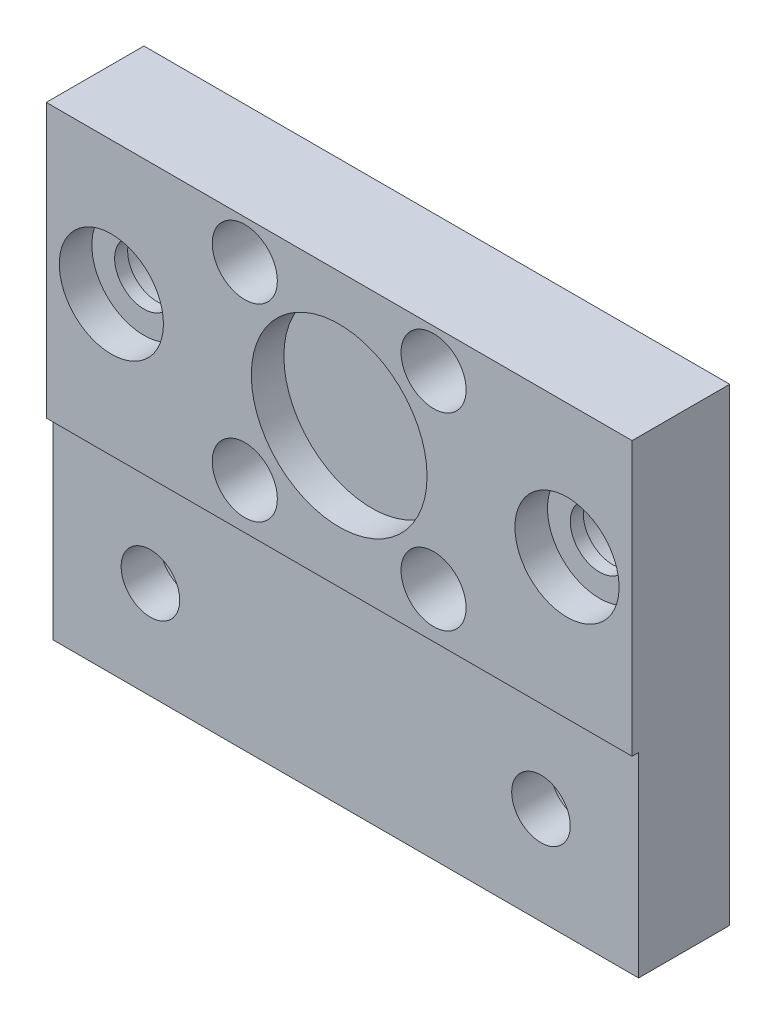
from build123d import *

# Parameters (mm, degrees)
SKETCH1_W                      = 90
SKETCH1_H                      = 72
BOSS_EXTRUDE1_DEPTH            = 15
SKETCH2_W                      = 90
SKETCH2_H                      = 30
CUT_EXTRUDE1_DEPTH             = 1
SKETCH3_R                      = 5
CUT_EXTRUDE2_DEPTH             = 60.548299724
SKETCH4_R                      = 13.5
SKETCH4_R_2                    = 8
CUT_EXTRUDE3_DEPTH             = 5
CBORE_FOR_M8_SHCS1_D           = 9
CBORE_FOR_M8_SHCS1_DEPTH       = 15
CBORE_FOR_M8_SHCS1_CBORE_D     = 15
CBORE_FOR_M8_SHCS1_CBORE_DEPTH = 8
CBORE_FOR_M8_SHCS1_TIP         = 2.703872786


with BuildPart() as part:
    # Sketch1 → Boss-Extrude1 (new body)
    with BuildSketch(Plane.XY):
        Rectangle(SKETCH1_W, SKETCH1_H)
    extrude(amount=BOSS_EXTRUDE1_DEPTH)

    # Sketch2 → Cut-Extrude1 (cut)
    with BuildSketch(Plane.XY.offset(15)):
        with Locations((0, -21)):
            Rectangle(SKETCH2_W, SKETCH2_H)
    extrude(amount=-CUT_EXTRUDE1_DEPTH, mode=Mode.SUBTRACT)

    # Sketch3 → Cut-Extrude2 (cut, through all)
    with BuildSketch(Plane.XY.offset(15)):
        with Locations((-14.5, 30)):
            Circle(SKETCH3_R)
        with Locations((14.5, 30)):
            Circle(SKETCH3_R)
        with Locations((14.5, 1)):
            Circle(SKETCH3_R)
        with Locations((-14.5, 1)):
            Circle(SKETCH3_R)
    extrude(amount=-CUT_EXTRUDE2_DEPTH, mode=Mode.SUBTRACT)

    # Sketch4 → Cut-Extrude3 (cut)
    with BuildSketch(Plane.XY.offset(15)):
        with Locations((0, 15.5)):
            Circle(SKETCH4_R)
        with Locations((-35, 15.5)):
            Circle(SKETCH4_R_2)
        with Locations(Location((35, 15.5, 0), (0, 0, 180))):
            Circle(SKETCH4_R_2)
    extrude(amount=-CUT_EXTRUDE3_DEPTH, mode=Mode.SUBTRACT)

    # CBORE for M8 SHCS1
    with Locations(Plane(origin=(0, 0, 0), x_dir=(-1, 0, 0), z_dir=(0, 0, -1))):
        with Locations((30, -21), (-30, -21), (-35, 15.5), (35, 15.5)):
            CounterBoreHole(CBORE_FOR_M8_SHCS1_D / 2, CBORE_FOR_M8_SHCS1_CBORE_D / 2, CBORE_FOR_M8_SHCS1_CBORE_DEPTH, depth=CBORE_FOR_M8_SHCS1_DEPTH)
            with Locations((0, 0, -(CBORE_FOR_M8_SHCS1_DEPTH + CBORE_FOR_M8_SHCS1_TIP / 2))):  # 118° drill point
                Cone(0, CBORE_FOR_M8_SHCS1_D / 2, CBORE_FOR_M8_SHCS1_TIP, mode=Mode.SUBTRACT)


solid = part.part
